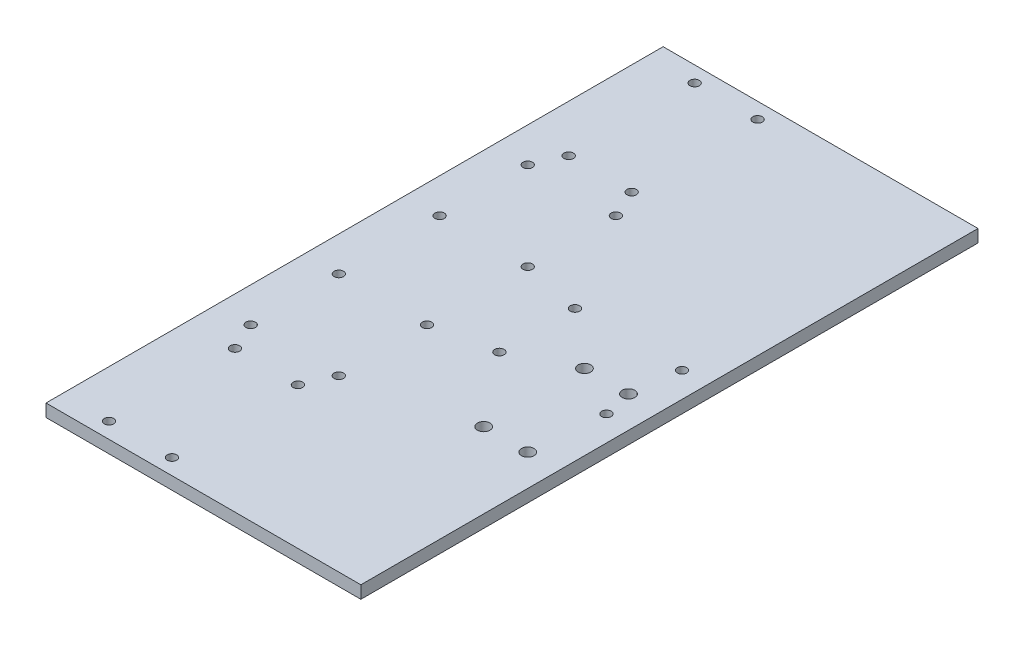
from build123d import *

# Parameters (mm, degrees)
SKETCH_1_W                  = 100
SKETCH_1_H                  = 160
EXTRUDE_1_DEPTH             = 4
SKETCH_2_R                  = 2
CUT_EXTRUDE_1_DEPTH         = 4
SKETCH_3_R                  = 1.5
CUT_EXTRUDE_2_DEPTH         = 4
SKETCH_4_R                  = 1.5
CUT_EXTRUDE_3_DEPTH         = 4
SKETCH_6_W                  = 100
SKETCH_6_H                  = 4
EXTRUDE_2_DEPTH             = 18
SKETCH_5_R                  = 1.5
CUT_EXTRUDE_4_DEPTH         = 10
PATTERN_LINEAR_1_COUNT      = 2
PATTERN_LINEAR_1_PITCH      = 40
PATTERN_LINEAR_1_COUNT_DIR2 = 2
PATTERN_LINEAR_1_PITCH_DIR2 = 20
MIRROR_3_COPY_1_SKETCH_R    = 1.5
MIRROR_3_COPY_1_DEPTH       = 10
MIRROR_3_COPY_2_SKETCH_R    = 1.5
MIRROR_3_COPY_2_DEPTH       = 10
MIRROR_3_COPY_3_SKETCH_R    = 1.5
MIRROR_3_COPY_3_DEPTH       = 10


with BuildPart() as part:
    # 草图1 → 凸台-拉伸1 (new body)
    with BuildSketch(Plane(origin=(0, 0, 0), x_dir=(1, 0, 0), z_dir=(0, 1, 0))):
        Rectangle(SKETCH_1_W, SKETCH_1_H)
    extrude(amount=EXTRUDE_1_DEPTH)

    # 草图2 → 切除-拉伸1 (cut)
    with BuildSketch(Plane(origin=(0, 4, 0), x_dir=(1, 0, 0), z_dir=(0, 1, 0))):
        with Locations(Location((40, -3, 0), (0, 0, 270))):
            Circle(SKETCH_2_R)
        with Locations(Location((26, -3, 0), (0, 0, 270))):
            Circle(SKETCH_2_R)
        with Locations(Location((40, -35, 0), (0, 0, 90))):
            Circle(SKETCH_2_R)
        with Locations(Location((26, -35, 0), (0, 0, 90))):
            Circle(SKETCH_2_R)
    extrude(amount=-CUT_EXTRUDE_1_DEPTH, mode=Mode.SUBTRACT)

    # 草图3 → 切除-拉伸2 (cut)
    with BuildSketch(Plane(origin=(0, 4, 0), x_dir=(1, 0, 0), z_dir=(0, 1, 0))):
        with Locations(Location((-39, 44, 0), (0, 0, 270))):
            Circle(SKETCH_3_R)
        with Locations(Location((-11, 44, 0), (0, 0, 270))):
            Circle(SKETCH_3_R)
        with Locations(Location((-11, 16, 0), (0, 0, 270))):
            Circle(SKETCH_3_R)
        with Locations(Location((-39, 16, 0), (0, 0, 270))):
            Circle(SKETCH_3_R)
    cut_extrude_2 = extrude(amount=-CUT_EXTRUDE_2_DEPTH, mode=Mode.SUBTRACT)

    # 镜向1: 切除-拉伸2 across plane
    add(cut_extrude_2.mirror(Plane.XY), mode=Mode.SUBTRACT)

    # 草图4 → 切除-拉伸3 (cut)
    with BuildSketch(Plane(origin=(0, 4, 0), x_dir=(1, 0, 0), z_dir=(0, 1, 0))):
        with Locations(Location((42, 12, 0), (0, 0, 270))):
            Circle(SKETCH_4_R)
        with Locations(Location((8, 12, 0), (0, 0, 90))):
            Circle(SKETCH_4_R)
        with Locations(Location((42, -12, 0), (0, 0, 90))):
            Circle(SKETCH_4_R)
        with Locations(Location((8, -12, 0), (0, 0, 270))):
            Circle(SKETCH_4_R)
    extrude(amount=-CUT_EXTRUDE_3_DEPTH, mode=Mode.SUBTRACT)

    # 草图6 → 凸台-拉伸2 (add)
    with BuildSketch(Plane(origin=(0, 0, -80), x_dir=(-1, 0, 0), z_dir=(0, 0, -1))):
        with Locations((0, 2)):
            Rectangle(SKETCH_6_W, SKETCH_6_H)
    extrude_2 = extrude(amount=EXTRUDE_2_DEPTH)

    # 草图5 → 切除-拉伸4 (cut)
    with BuildSketch(Plane(origin=(0, 4, 0), x_dir=(1, 0, 0), z_dir=(0, 1, 0))):
        with Locations(Location((-35, 93, 0), (0, 0, 270))):
            Circle(SKETCH_5_R)
    cut_extrude_4 = extrude(amount=-CUT_EXTRUDE_4_DEPTH, mode=Mode.SUBTRACT)

    # 镜向2: 凸台-拉伸2 across plane
    add(extrude_2.mirror(Plane.XY))

    # 阵列(线性)1: Cut-Extrude 4 2 × 2
    with Locations(*[(j * PATTERN_LINEAR_1_PITCH_DIR2, 0, i * PATTERN_LINEAR_1_PITCH) for i in range(PATTERN_LINEAR_1_COUNT) for j in range(PATTERN_LINEAR_1_COUNT_DIR2) if (i, j) != (0, 0)]):
        add(cut_extrude_4, mode=Mode.SUBTRACT)

    # 镜向3: 切除-拉伸4 across plane
    add(cut_extrude_4.mirror(Plane.XY), mode=Mode.SUBTRACT)

    # 镜向3 copy 1 sketch → 镜向3 copy 1 (cut)
    with BuildSketch(Plane(origin=(20, 4, 0), x_dir=(1, 0, 0), z_dir=(0, 1, 0))):
        with Locations((-35, -93)):
            Circle(MIRROR_3_COPY_1_SKETCH_R)
    extrude(amount=-MIRROR_3_COPY_1_DEPTH, mode=Mode.SUBTRACT)

    # 镜向3 copy 2 sketch → 镜向3 copy 2 (cut)
    with BuildSketch(Plane(origin=(0, 4, -40), x_dir=(1, 0, 0), z_dir=(0, 1, 0))):
        with Locations((-35, -93)):
            Circle(MIRROR_3_COPY_2_SKETCH_R)
    extrude(amount=-MIRROR_3_COPY_2_DEPTH, mode=Mode.SUBTRACT)

    # 镜向3 copy 3 sketch → 镜向3 copy 3 (cut)
    with BuildSketch(Plane(origin=(20, 4, -40), x_dir=(1, 0, 0), z_dir=(0, 1, 0))):
        with Locations((-35, -93)):
            Circle(MIRROR_3_COPY_3_SKETCH_R)
    extrude(amount=-MIRROR_3_COPY_3_DEPTH, mode=Mode.SUBTRACT)


solid = part.part
